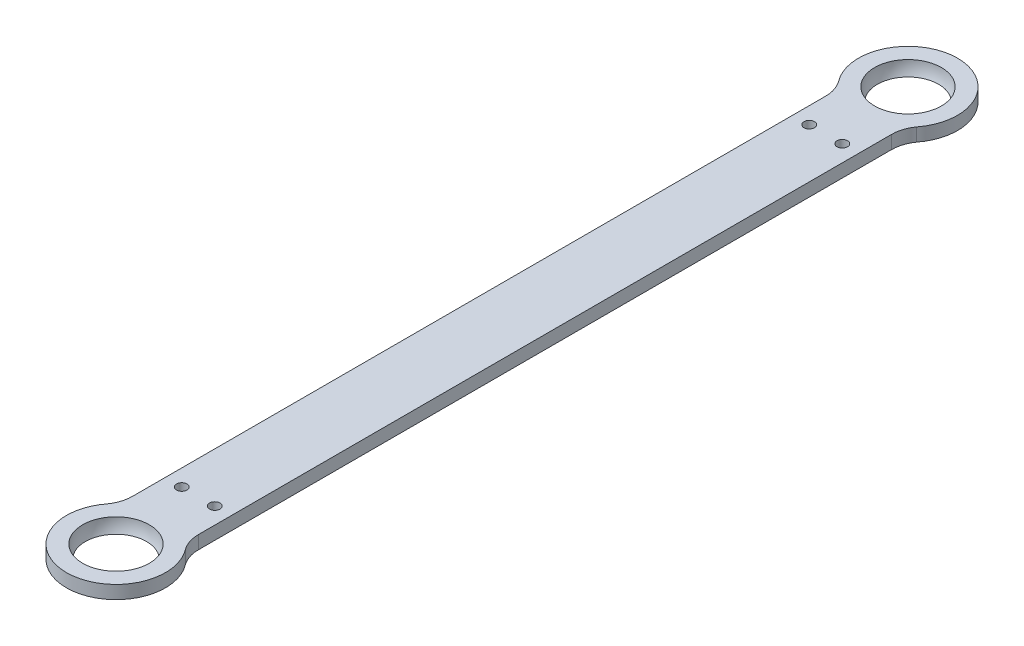
from build123d import *

# Parameters (mm, degrees)
BOSS_EXTRUDE1_DEPTH = 4
CUT_EXTRUDE1_DEPTH  = 1
SKETCH4_R           = 1.6
CUT_EXTRUDE2_DEPTH  = 10
BOSS_EXTRUDE2_START = 1
SKETCH6_R           = 1.6
BOSS_EXTRUDE2_DEPTH = 1
SKETCH7_W           = 20
SKETCH7_H           = 4
BOSS_EXTRUDE3_DEPTH = 85.1


with BuildPart() as part:
    # Sketch1 → Boss-Extrude1 (new body)
    with BuildSketch(Plane(origin=(0, 0, 0), x_dir=(1, 0, 0), z_dir=(0, 1, 0))):
        with BuildLine():
            Line((-10, -15), (-10, -34.803693177))
            Line((-10, -34.803693177), (10, -34.803693177))
            Line((10, -34.803693177), (10, -15))
            ThreePointArc((10, -15), (10.472630633, -11.957512347), (11.845976177, -9.201785066))
            ThreePointArc((11.845976177, -9.201785066), (0, 15), (-11.845976177, -9.201785066))
            ThreePointArc((-11.845976177, -9.201785066), (-10.472630633, -11.957512347), (-10, -15))
        make_face()
    extrude(amount=BOSS_EXTRUDE1_DEPTH)

    # Sketch2 → Cut-Revolve1 (revolve, cut)
    with BuildSketch(Plane(origin=(0, 4, 0), x_dir=(1, 0, 0), z_dir=(0, 1, 0))):
        with BuildLine():
            Line((0, 10.1), (0, -10.1))
            ThreePointArc((0, -10.1), (10.1, 0), (0, 10.1))
        make_face()
    revolve(axis=Axis((0, 4, -10.1), (0, 0, 1)), mode=Mode.SUBTRACT)

    # Sketch3 → Cut-Extrude1 (cut)
    with BuildSketch(Plane(origin=(0, 4, 0), x_dir=(1, 0, 0), z_dir=(0, 1, 0))):
        with BuildLine():
            Line((10, -24.901846588), (10, -39.974302239))
            ThreePointArc((10, -39.974302239), (0, -49.974302239), (-10, -39.974302239))
            Line((-10, -39.974302239), (-10, -24.901846588))
            ThreePointArc((-10, -24.901846588), (0, -14.901846588), (10, -24.901846588))
        make_face()
    extrude(amount=-CUT_EXTRUDE1_DEPTH, mode=Mode.SUBTRACT)

    # Sketch4 → Cut-Extrude2 (cut)
    with BuildSketch(Plane(origin=(0, 3, 0), x_dir=(1, 0, 0), z_dir=(0, 1, 0))):
        with Locations(Location((5, -24.901846588, 0), (0, 0, 270))):
            Circle(SKETCH4_R)
        with Locations(Location((-5, -24.901846588, 0), (0, 0, 90))):
            Circle(SKETCH4_R)
    extrude(amount=-CUT_EXTRUDE2_DEPTH, mode=Mode.SUBTRACT)

    # Sketch6 → Boss-Extrude2 (add)
    with BuildSketch(Plane(origin=(0, 3, 0), x_dir=(1, 0, 0), z_dir=(0, 1, 0)).offset(BOSS_EXTRUDE2_START)):
        with BuildLine():
            Line((-10, -24.901846588), (-10, -34.803693177))
            Line((-10, -34.803693177), (10, -34.803693177))
            Line((10, -34.803693177), (10, -24.901846588))
            ThreePointArc((10, -24.901846588), (0, -14.901846588), (-10, -24.901846588))
        make_face()
        with Locations(Location((-5, -24.901846588, 0), (0, 0, 90))):
            Circle(SKETCH6_R, mode=Mode.SUBTRACT)
        with Locations(Location((5, -24.901846588, 0), (0, 0, 90))):
            Circle(SKETCH6_R, mode=Mode.SUBTRACT)
    extrude(amount=-BOSS_EXTRUDE2_DEPTH)

    # Sketch7 → Boss-Extrude3 (add)
    with BuildSketch(Plane.XY.offset(34.803693177)):
        with Locations((0, 2)):
            Rectangle(SKETCH7_W, SKETCH7_H)
    extrude(amount=BOSS_EXTRUDE3_DEPTH)

    # Mirror3: part across plane


with BuildPart() as part_1:
    add(part.part)
    add(part.part.mirror(Plane(origin=(0, 0, 119.903693177), x_dir=(1, 0, 0), z_dir=(0, 0, -1))))


solid = part_1.part
